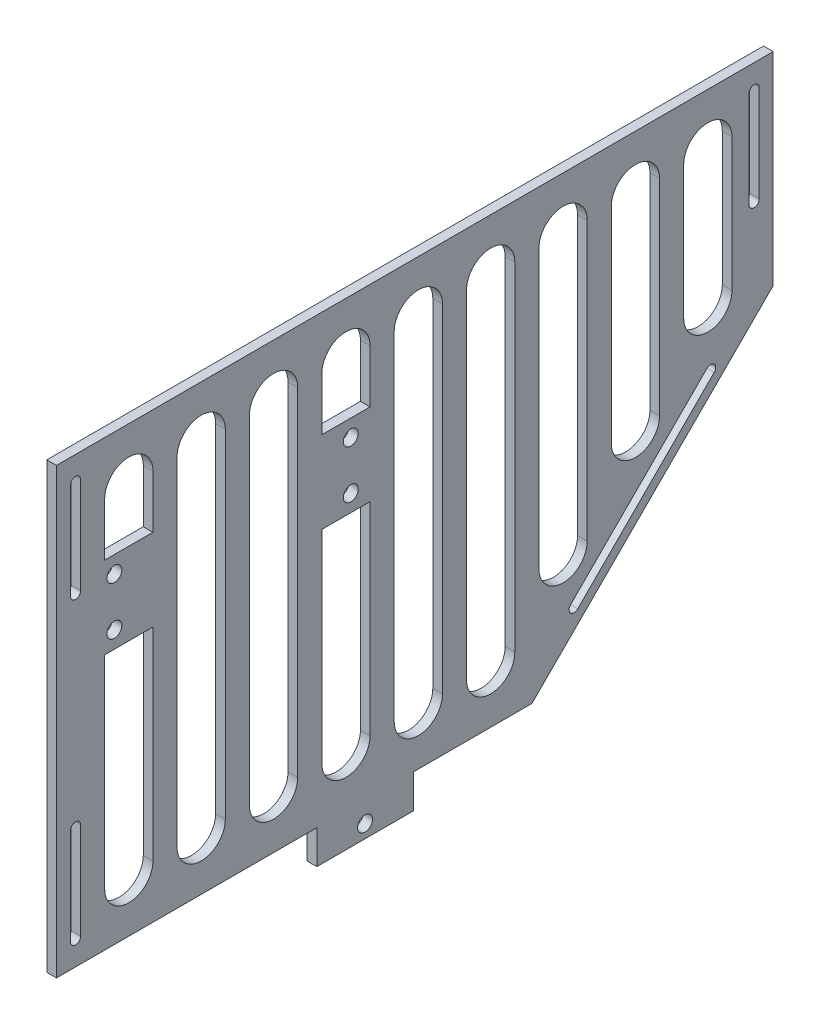
from build123d import *

# Parameters (mm, degrees)
SKETCH_2_W               = 148.55
SKETCH_2_H               = 92
EXTRUDE_1_DEPTH          = 2
CUT_EXTRUDE_1_DEPTH      = 88.388647003
CUT_EXTRUDE_1_DEPTH_BACK = 2
CUT_EXTRUDE_2_DEPTH      = 2
SKETCH_5_W               = 20
SKETCH_5_H               = 7
SKETCH_5_R               = 1.55
EXTRUDE_2_DEPTH          = 2
CUT_EXTRUDE_3_DEPTH      = 2
SKETCH_8_W               = 10
SKETCH_8_H               = 17
EXTRUDE_3_DEPTH          = 2
SKETCH_7_R               = 1.55
CUT_EXTRUDE_4_DEPTH      = 2
CUT_EXTRUDE_5_DEPTH      = 2


with BuildPart() as part:
    # 草图2 → 凸台-拉伸1 (new body)
    with BuildSketch(Plane(origin=(0, 0, 0), x_dir=(0, 0, -1), z_dir=(1, 0, 0))):
        Rectangle(SKETCH_2_W, SKETCH_2_H)
    extrude(amount=EXTRUDE_1_DEPTH)

    # 草图3 → 切除-拉伸1 (cut, two sides: drawn at the far end of the back side and taken through both)
    with BuildSketch(Plane(origin=(2, 0, 0), x_dir=(0, 0, -1), z_dir=(1, 0, 0)).offset(-CUT_EXTRUDE_1_DEPTH_BACK)):
        Polygon((-204.458434938, -274.733434938), (24.275, -46), (74.275, 4), (303.008434938, 232.733434938), (760.475304814, -224.733434938), (253.008434938, -732.200304814), align=None)
    extrude(amount=CUT_EXTRUDE_1_DEPTH + CUT_EXTRUDE_1_DEPTH_BACK, mode=Mode.SUBTRACT)

    # 草图4 → 切除-拉伸2 (cut)
    with BuildSketch(Plane(origin=(2, 0, 0), x_dir=(0, 0, -1), z_dir=(1, 0, 0))):
        with BuildLine():
            Line((-71.365, -41), (-71.365, -21))
            ThreePointArc((-71.365, -21), (-70.315, -19.95), (-69.265, -21))
            Line((-69.265, -21), (-69.265, -41))
            ThreePointArc((-69.265, -41), (-70.315, -42.05), (-71.365, -41))
        make_face()
        with BuildLine():
            Line((-71.365, 41), (-71.365, 21))
            ThreePointArc((-71.365, 21), (-70.315, 19.95), (-69.265, 21))
            Line((-69.265, 21), (-69.265, 41))
            ThreePointArc((-69.265, 41), (-70.315, 42.05), (-71.365, 41))
        make_face()
        with BuildLine():
            Line((71.365, 41), (71.365, 21))
            ThreePointArc((71.365, 21), (70.315, 19.95), (69.265, 21))
            Line((69.265, 21), (69.265, 41))
            ThreePointArc((69.265, 41), (70.315, 42.05), (71.365, 41))
        make_face()
    extrude(amount=-CUT_EXTRUDE_2_DEPTH, mode=Mode.SUBTRACT)

    # 草图5 → 凸台-拉伸2 (add)
    with BuildSketch(Plane(origin=(2, 0, 0), x_dir=(0, 0, -1), z_dir=(1, 0, 0))):
        with Locations((-10.315, -49.5)):
            Rectangle(SKETCH_5_W, SKETCH_5_H)
        with Locations((-10.315, -50.25)):
            Circle(SKETCH_5_R, mode=Mode.SUBTRACT)
    extrude(amount=-EXTRUDE_2_DEPTH)

    # 草图6 → 切除-拉伸3 (cut)
    with BuildSketch(Plane(origin=(2, 0, 0), x_dir=(0, 0, -1), z_dir=(1, 0, 0))):
        with BuildLine():
            Line((-64.275, -35), (-64.275, 35))
            ThreePointArc((-64.275, 35), (-59.275, 40), (-54.275, 35))
            Line((-54.275, 35), (-54.275, -35))
            ThreePointArc((-54.275, -35), (-59.275, -40), (-64.275, -35))
        make_face()
        with BuildLine():
            Line((-49.275, -35), (-49.275, 35))
            ThreePointArc((-49.275, 35), (-44.275, 40), (-39.275, 35))
            Line((-39.275, 35), (-39.275, -35))
            ThreePointArc((-39.275, -35), (-44.275, -40), (-49.275, -35))
        make_face()
        with BuildLine():
            Line((-34.275, -35), (-34.275, 35))
            ThreePointArc((-34.275, 35), (-29.275, 40), (-24.275, 35))
            Line((-24.275, 35), (-24.275, -35))
            ThreePointArc((-24.275, -35), (-29.275, -40), (-34.275, -35))
        make_face()
        with BuildLine():
            Line((-19.275, -35), (-19.275, 35))
            ThreePointArc((-19.275, 35), (-14.275, 40), (-9.275, 35))
            Line((-9.275, 35), (-9.275, -35))
            ThreePointArc((-9.275, -35), (-14.275, -40), (-19.275, -35))
        make_face()
        with BuildLine():
            Line((-4.275, -35), (-4.275, 35))
            ThreePointArc((-4.275, 35), (0.725, 40), (5.725, 35))
            Line((5.725, 35), (5.725, -35))
            ThreePointArc((5.725, -35), (0.725, -40), (-4.275, -35))
        make_face()
        with BuildLine():
            Line((10.725, -35), (10.725, 35))
            ThreePointArc((10.725, 35), (15.725, 40), (20.725, 35))
            Line((20.725, 35), (20.725, -35))
            ThreePointArc((20.725, -35), (15.725, -40), (10.725, -35))
        make_face()
        with BuildLine():
            Line((25.725, -22.579437252), (25.725, 35))
            ThreePointArc((25.725, 35), (30.725, 40), (35.725, 35))
            Line((35.725, 35), (35.725, -22.579437252))
            ThreePointArc((35.725, -22.579437252), (30.725, -27.579437252), (25.725, -22.579437252))
        make_face()
        with BuildLine():
            Line((40.725, -7.579437252), (40.725, 35))
            ThreePointArc((40.725, 35), (45.725, 40), (50.725, 35))
            Line((50.725, 35), (50.725, -7.579437252))
            ThreePointArc((50.725, -7.579437252), (45.725, -12.579437252), (40.725, -7.579437252))
        make_face()
        with BuildLine():
            Line((55.725, 7.420562748), (55.725, 35))
            ThreePointArc((55.725, 35), (60.725, 40), (65.725, 35))
            Line((65.725, 35), (65.725, 7.420562748))
            ThreePointArc((65.725, 7.420562748), (60.725, 2.420562748), (55.725, 7.420562748))
        make_face()
    extrude(amount=-CUT_EXTRUDE_3_DEPTH, mode=Mode.SUBTRACT)

    # 草图8 → 凸台-拉伸3 (add)
    with BuildSketch(Plane(origin=(2, 0, 0), x_dir=(0, 0, -1), z_dir=(1, 0, 0))):
        with Locations((-59.275, 15.5)):
            Rectangle(SKETCH_8_W, SKETCH_8_H)
        with Locations((-14.275, 15.5)):
            Rectangle(SKETCH_8_W, SKETCH_8_H)
    extrude(amount=-EXTRUDE_3_DEPTH)

    # 草图7 → 切除-拉伸4 (cut)
    with BuildSketch(Plane(origin=(2, 0, 0), x_dir=(0, 0, -1), z_dir=(1, 0, 0))):
        with Locations((-62.275, 10.5)):
            Circle(SKETCH_7_R)
        with Locations(Location((-13.275, 10.5, 0), (0, 0, 180))):
            Circle(SKETCH_7_R)
        with Locations((-13.275, 20.5)):
            Circle(SKETCH_7_R)
        with Locations(Location((-62.275, 20.5, 0), (0, 0, 180))):
            Circle(SKETCH_7_R)
    extrude(amount=-CUT_EXTRUDE_4_DEPTH, mode=Mode.SUBTRACT)

    # 草图9 → 切除-拉伸5 (cut)
    with BuildSketch(Plane(origin=(2, 0, 0), x_dir=(0, 0, -1), z_dir=(1, 0, 0))):
        with BuildLine():
            Line((32.269081912, -32.27835316), (60.55335316, -3.994081912))
            ThreePointArc((60.55335316, -3.994081912), (62.0382774, -3.994081912), (62.0382774, -5.479006153))
            Line((62.0382774, -5.479006153), (33.754006153, -33.7632774))
            ThreePointArc((33.754006153, -33.7632774), (32.269081912, -33.7632774), (32.269081912, -32.27835316))
        make_face()
    extrude(amount=-CUT_EXTRUDE_5_DEPTH, mode=Mode.SUBTRACT)


solid = part.part
